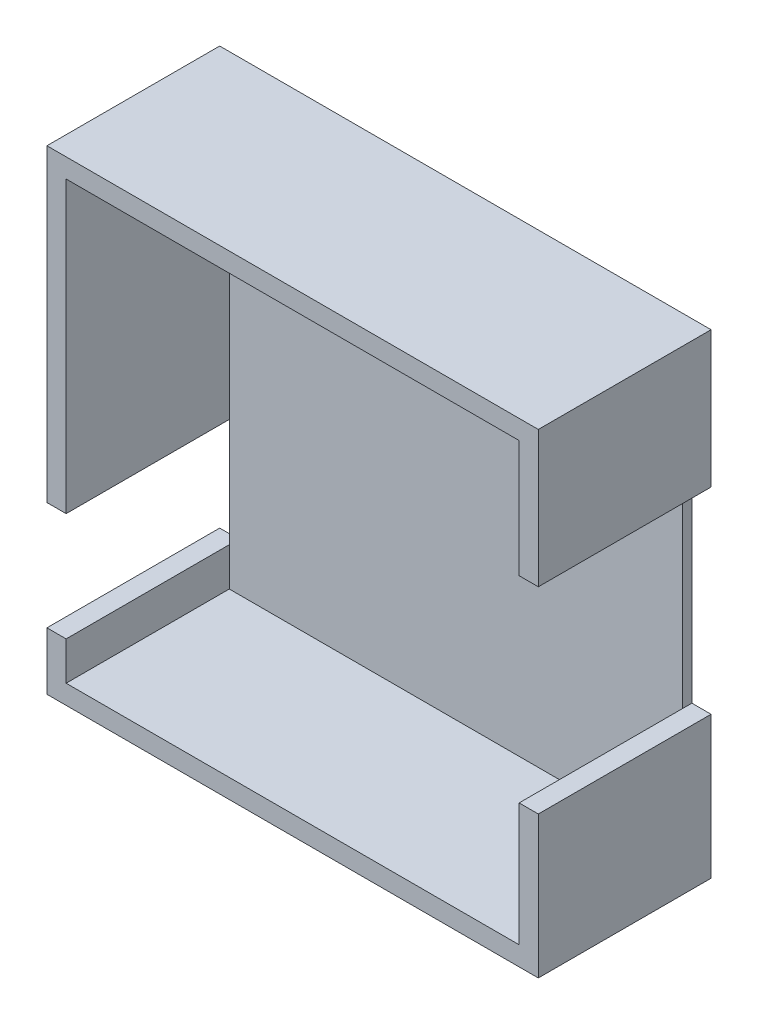
from build123d import *

# Parameters (mm, degrees)
ESQUISSE1_W             = 51.2
ESQUISSE1_H             = 49.5
ESQUISSE1_W_2           = 47.2
ESQUISSE1_H_2           = 45.5
BOSS_EXTRU_1_DEPTH      = 17
ESQUISSE2_W             = 1
ESQUISSE2_H             = 49.5
BOSS_EXTRU_2_DEPTH      = 51.2
ESQUISSE3_W             = 2
ESQUISSE3_H             = 20.5
ESQUISSE3_H_2           = 11.3
ENL_V_MAT_EXTRU_2_DEPTH = 19


with BuildPart() as part:
    # Esquisse1 → Boss.-Extru.1 (new body)
    with BuildSketch(Plane.XY):
        with Locations((-0.122014971, -22.887662338)):
            Rectangle(ESQUISSE1_W, ESQUISSE1_H)
        with Locations((-0.122014971, -22.887662338)):
            Rectangle(ESQUISSE1_W_2, ESQUISSE1_H_2, mode=Mode.SUBTRACT)
    extrude(amount=BOSS_EXTRU_1_DEPTH)

    # Esquisse2 → Boss.-Extru.2 (add)
    with BuildSketch(Plane(origin=(25.477985029, 0, 0), x_dir=(0, 0, -1), z_dir=(1, 0, 0))):
        with Locations((0.5, -22.887662338)):
            Rectangle(ESQUISSE2_W, ESQUISSE2_H)
    extrude(amount=-BOSS_EXTRU_2_DEPTH)

    # Esquisse3 → Enlèv. mat.-Extru.2 (cut)
    with BuildSketch(Plane.XY.offset(17)):
        with Locations((24.477985029, -22.587662338)):
            Rectangle(ESQUISSE3_W, ESQUISSE3_H)
        with Locations((-24.722014971, -35.987662338)):
            Rectangle(ESQUISSE3_W, ESQUISSE3_H_2)
    extrude(amount=-ENL_V_MAT_EXTRU_2_DEPTH, mode=Mode.SUBTRACT)


solid = part.part
